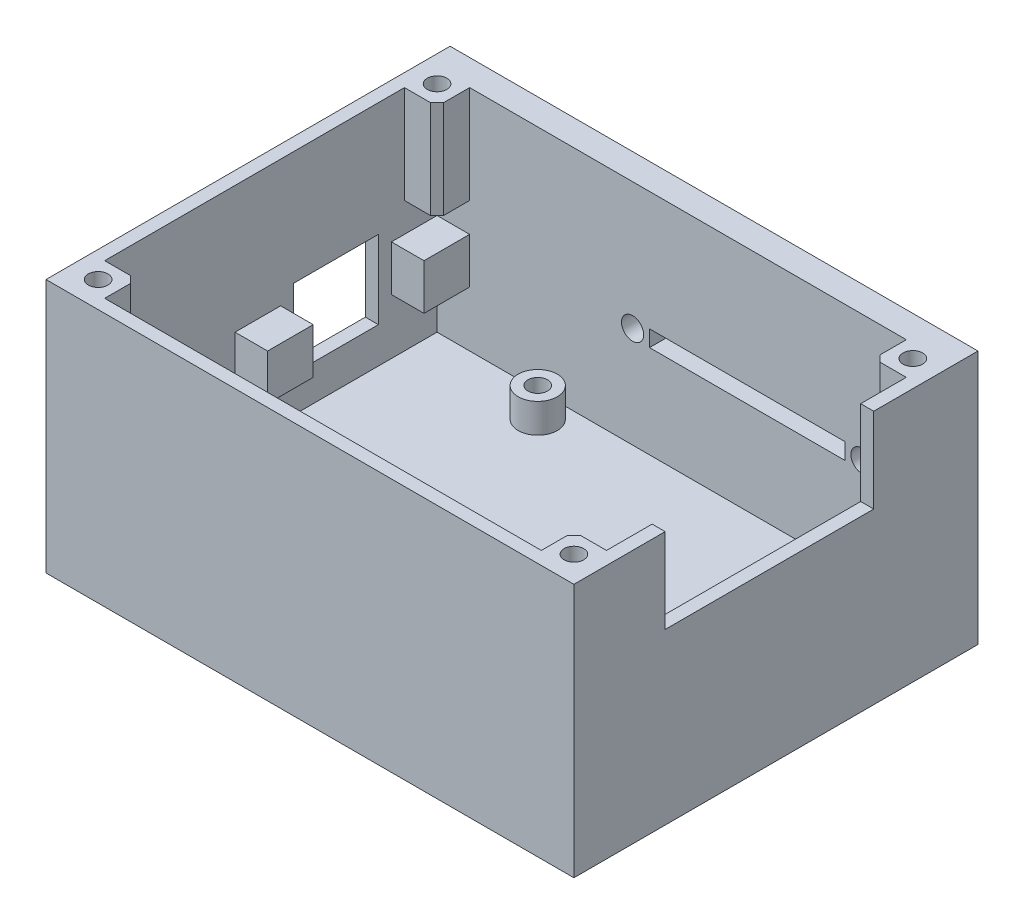
from build123d import *

# Parameters (mm, degrees)
SKETCH1_W           = 81
SKETCH1_H           = 62
EXTRUDE1_DEPTH      = 4
SKETCH2_W           = 81
SKETCH2_H           = 62
SKETCH2_W_2         = 77
SKETCH2_H_2         = 56
EXTRUDE2_DEPTH      = 35
SKETCH3_R           = 3
EXTRUDE3_DEPTH      = 4.5
SKETCH4_R           = 1.5
EXTRUDE4_DEPTH      = 4.5
EXTRUDE5_DEPTH      = 96.425363505
EXTRUDE5_DEPTH_BACK = 8
SKETCH5_R           = 1.25
SKETCH5_W           = 13
SKETCH5_H           = 12
EXTRUDE6_REACH      = 97.425
SKETCH6_W           = 32
SKETCH6_H           = 13
EXTRUDE12_START     = 24
SKETCH8_W           = 5
SKETCH8_H           = 5
EXTRUDE12_DEPTH     = 15
SKETCH10_R          = 1.5
EXTRUDE13_DEPTH     = 10
CHAMFER5_SIZE       = 1
SKETCH12_R          = 1.7
SKETCH12_W          = 30
SKETCH12_H          = 2.5
EXTRUDE15_DEPTH     = 4
SKETCH13_W          = 7
SKETCH13_H          = 7
EXTRUDE16_DEPTH     = 5
SKETCH14_R          = 1.25
EXTRUDE17_DEPTH     = 3
EXTRUDE18_DEPTH     = 1


with BuildPart() as part:
    # Sketch1 → Extrude1 (new body)
    with BuildSketch(Plane(origin=(0, 0, 0), x_dir=(1, 0, 0), z_dir=(0, 1, 0))):
        with Locations((0, 1)):
            Rectangle(SKETCH1_W, SKETCH1_H)
    extrude(amount=EXTRUDE1_DEPTH)

    # Sketch2 → Extrude2 (add)
    with BuildSketch(Plane(origin=(0, 4, 0), x_dir=(1, 0, 0), z_dir=(0, 1, 0))):
        with Locations((0, 1)):
            Rectangle(SKETCH2_W, SKETCH2_H)
        Rectangle(SKETCH2_W_2, SKETCH2_H_2, mode=Mode.SUBTRACT)
    extrude(amount=EXTRUDE2_DEPTH)

    # Sketch3 → Extrude3 (add)
    with BuildSketch(Plane(origin=(0, 4, 0), x_dir=(1, 0, 0), z_dir=(0, 1, 0))):
        with Locations(Location((31.6, -18.95, 0), (0, 0, 270))):
            Circle(SKETCH3_R)
        with Locations(Location((-20.3, -23.65, 0), (0, 0, 270))):
            Circle(SKETCH3_R)
        with Locations(Location((-19.2, 24.15, 0), (0, 0, 270))):
            Circle(SKETCH3_R)
        with Locations(Location((31.6, 8.95, 0), (0, 0, 270))):
            Circle(SKETCH3_R)
    extrude(amount=EXTRUDE3_DEPTH)

    # Sketch4 → Extrude4 (cut)
    with BuildSketch(Plane(origin=(0, 8.5, 0), x_dir=(1, 0, 0), z_dir=(0, 1, 0))):
        with Locations(Location((-19.2, 24.15, 0), (0, 0, 270))):
            Circle(SKETCH4_R)
        with Locations(Location((31.6, 8.95, 0), (0, 0, 270))):
            Circle(SKETCH4_R)
        with Locations(Location((31.6, -18.95, 0), (0, 0, 270))):
            Circle(SKETCH4_R)
        with Locations(Location((-20.3, -23.65, 0), (0, 0, 270))):
            Circle(SKETCH4_R)
    extrude(amount=-EXTRUDE4_DEPTH, mode=Mode.SUBTRACT)

    # Sketch5 → Extrude5 (cut, two sides: drawn at the far end of the back side and taken through both)
    with BuildSketch(Plane.ZY.offset(40.5).offset(-EXTRUDE5_DEPTH_BACK)):
        with Locations(Location((-0.5, 16, 0), (0, 0, 180))):
            Circle(SKETCH5_R)
        with Locations(Location((-24.5, 16, 0), (0, 0, 180))):
            Circle(SKETCH5_R)
        with Locations((-12.5, 15.5)):
            Rectangle(SKETCH5_W, SKETCH5_H)
    extrude(amount=EXTRUDE5_DEPTH + EXTRUDE5_DEPTH_BACK, mode=Mode.SUBTRACT)

    # Sketch6 → Extrude6 (cut, up to next)
    with BuildSketch(Plane(origin=(40.5, 0, 0), x_dir=(0, 0, -1), z_dir=(1, 0, 0)), mode=Mode.PRIVATE) as extrude6_sk1:
        with Locations((0, 32.5)):
            Rectangle(SKETCH6_W, SKETCH6_H)
    extrude6_tool1 = extrude(extrude6_sk1.sketch, amount=-EXTRUDE6_REACH, mode=Mode.PRIVATE) & part.part
    add(extrude6_tool1.solids().sort_by_distance((40.5, 32.5, 0))[0], mode=Mode.SUBTRACT)

    # Sketch8 → Extrude12 (add)
    with BuildSketch(Plane(origin=(0, 0, 0), x_dir=(1, 0, 0), z_dir=(0, 1, 0)).offset(EXTRUDE12_START)):
        with Locations((-36, 25.5)):
            Rectangle(SKETCH8_W, SKETCH8_H)
        with Locations((-36, -25.5)):
            Rectangle(SKETCH8_W, SKETCH8_H)
        with Locations((36, 25.5)):
            Rectangle(SKETCH8_W, SKETCH8_H)
        with Locations((36, -25.5)):
            Rectangle(SKETCH8_W, SKETCH8_H)
    extrude(amount=EXTRUDE12_DEPTH)

    # Sketch10 → Extrude13 (cut)
    with BuildSketch(Plane(origin=(0, 39, 0), x_dir=(1, 0, 0), z_dir=(0, 1, 0))):
        with Locations(Location((-36.5, 26, 0), (0, 0, 270))):
            Circle(SKETCH10_R)
        with Locations(Location((36.5, 26, 0), (0, 0, 270))):
            Circle(SKETCH10_R)
        with Locations(Location((36.5, -26, 0), (0, 0, 270))):
            Circle(SKETCH10_R)
        with Locations(Location((-36.5, -26, 0), (0, 0, 270))):
            Circle(SKETCH10_R)
    extrude(amount=-EXTRUDE13_DEPTH, mode=Mode.SUBTRACT)

    # Chamfer5
    chamfer5_edges = [part.edges().sort_by_distance(p)[0] for p in [
        (-33.5, 31.5, -23),
        (-33.5, 31.5, 23),
        (33.5, 31.5, -23),
        (33.5, 31.5, 23),
    ]]
    chamfer(chamfer5_edges, length=CHAMFER5_SIZE)

    # Sketch12 → Extrude15 (cut)
    with BuildSketch(Plane(origin=(0, 0, -32), x_dir=(-1, 0, 0), z_dir=(0, 0, -1))):
        with Locations((-26.7, 19.5)):
            Circle(SKETCH12_R)
        with Locations((8.5, 19.5)):
            Circle(SKETCH12_R)
        with Locations((-9.1, 19.5)):
            Rectangle(SKETCH12_W, SKETCH12_H)
    extrude(amount=-EXTRUDE15_DEPTH, mode=Mode.SUBTRACT)

    # Sketch13 → Extrude16 (add)
    with BuildSketch(Plane(origin=(-38.5, 0, 0), x_dir=(0, 0, -1), z_dir=(1, 0, 0))):
        with Locations((0.5, 16)):
            Rectangle(SKETCH13_W, SKETCH13_H)
        with Locations((24.5, 16)):
            Rectangle(SKETCH13_W, SKETCH13_H)
    extrude(amount=EXTRUDE16_DEPTH)

    # Sketch14 → Extrude17 (cut)
    with BuildSketch(Plane.ZY.offset(38.5)):
        with Locations(Location((-0.5, 16, 0), (0, 0, 180))):
            Circle(SKETCH14_R)
        with Locations(Location((-24.5, 16, 0), (0, 0, 180))):
            Circle(SKETCH14_R)
    extrude(amount=-EXTRUDE17_DEPTH, mode=Mode.SUBTRACT)

    # Sketch15 → Extrude18 (cut)
    # profile 1 of 3: a face of its own
    with BuildSketch(Plane.XZ):
        with BuildLine():
            Line((-11.468328751, 5.454636927), (-14.100540289, 2.938611286))
            add(Edge.make_bspline(
                [(-14.100540289, 2.938611286), (-14.323825916, 3.169488999), (-14.759972698, 3.620465502), (-15.462769298, 4.21751865), (-16.193652173, 4.715081665), (-16.938403455, 5.134126068), (-17.710419061, 5.451163024), (-18.500772389, 5.682193194), (-19.314510076, 5.823043557), (-19.865216444, 5.839159331), (-20.142206956, 5.847265132)],
                knots=[0, 0, 0, 0, 1.115251505, 2.178435587, 3.19620269, 4.182487026, 5.141301733, 6.088180966, 7.038406374, 8, 8, 8, 8], degree=3))
            add(Edge.make_bspline(
                [(-20.142206956, 5.847265132), (-20.373527694, 5.840861266), (-20.830013685, 5.828223941), (-21.500254742, 5.735579883), (-22.141374952, 5.57803463), (-22.75556897, 5.360908089), (-23.341029506, 5.079957868), (-23.898984048, 4.735401417), (-24.428056984, 4.330350569), (-24.921259567, 3.866901077), (-25.372423956, 3.36054768), (-25.771056422, 2.820269814), (-26.104975056, 2.247305224), (-26.379016647, 1.647456476), (-26.592484454, 1.017947171), (-26.744927287, 0.359201121), (-26.833096148, -0.32956619), (-26.846255941, -0.797785076), (-26.852944135, -1.035747688)],
                knots=[0, 0, 0, 0, 1.035432265, 2.043311493, 3.022114605, 3.98653278, 4.95457646, 5.923598177, 6.917315552, 7.932509744, 8.948865224, 9.949768934, 10.933144597, 11.912367597, 12.897413939, 13.903909035, 14.934704909, 16, 16, 16, 16], degree=3))
            add(Edge.make_bspline(
                [(-26.852944135, -1.035747688), (-26.851016674, -1.202766499), (-26.847217608, -1.531964006), (-26.805630115, -2.018938485), (-26.738664445, -2.491418856), (-26.641748528, -2.948689437), (-26.520554222, -3.391146502), (-26.378365706, -3.822607107), (-26.199992303, -4.237109437), (-26.001995135, -4.639467668), (-25.77172671, -5.018702952), (-25.523454869, -5.380335269), (-25.254244592, -5.722591933), (-24.962352188, -6.044073789), (-24.643669634, -6.339756795), (-24.306433697, -6.618532492), (-23.944955671, -6.873422179), (-23.566744372, -7.110822593), (-23.168532533, -7.317054352), (-22.761124562, -7.503860484), (-22.338343335, -7.655574837), (-21.905336468, -7.777870446), (-21.463651372, -7.881864597), (-21.00896796, -7.945896992), (-20.545227765, -7.994387975), (-20.231817232, -7.99738201), (-20.074097982, -7.998888714)],
                knots=[0, 0, 0, 0, 1.103660481, 2.175337485, 3.227646561, 4.255952547, 5.262355991, 6.258840057, 7.255597736, 8.242457506, 9.22035537, 10.185017736, 11.140346927, 12.096287581, 13.051739095, 14.01125915, 14.986044842, 15.97314143, 16.960198552, 17.947847494, 18.933482797, 19.925264591, 20.920966487, 21.929612487, 22.958107872, 24, 24, 24, 24], degree=3))
            add(Edge.make_bspline(
                [(-20.074097982, -7.998888714), (-19.806579028, -7.991150646), (-19.280973849, -7.975947355), (-18.509572673, -7.857059772), (-17.774504203, -7.661496426), (-17.187188013, -7.430547477), (-16.727041292, -7.202482393), (-16.376738395, -6.99153342), (-16.014497897, -6.755563834), (-15.646336304, -6.485667885), (-15.268112526, -6.185084434), (-14.886503087, -5.847230143), (-14.491738716, -5.483230068), (-14.233132489, -5.223436064), (-14.100540289, -5.090234868)],
                knots=[0, 0, 0, 0, 1.404581149, 2.759636711, 4.088442092, 5.392261763, 6.066678138, 6.783632037, 7.538459478, 8.336747902, 9.180226004, 10.074962426, 11.012997595, 12, 12, 12, 12], degree=3))
            Line((-14.100540289, -5.090234868), (-11.548456956, -7.770523329))
            add(Edge.make_bspline(
                [(-11.548456956, -7.770523329), (-11.727854678, -7.943726197), (-12.078000665, -8.281781155), (-12.606186166, -8.76178765), (-13.133706924, -9.193126846), (-13.647819138, -9.591454465), (-14.156944501, -9.945166256), (-14.661029022, -10.254615477), (-15.154366243, -10.527628544), (-15.647200469, -10.759601226), (-16.142598371, -10.956570126), (-16.652304594, -11.126147421), (-17.177877359, -11.269603712), (-17.722526625, -11.385354098), (-18.281172234, -11.478170281), (-18.859042369, -11.540820668), (-19.452473046, -11.582938439), (-19.855006267, -11.58672307), (-20.058072341, -11.588632303)],
                knots=[0, 0, 0, 0, 1.244526981, 2.429050516, 3.560637417, 4.644440555, 5.67424972, 6.652764056, 7.595344123, 8.486817594, 9.369275933, 10.254498637, 11.166417451, 12.086725134, 13.032340136, 13.991389299, 14.986715468, 16, 16, 16, 16], degree=3))
            add(Edge.make_bspline(
                [(-20.058072341, -11.588632303), (-20.431079563, -11.579123606), (-21.160951014, -11.560517727), (-22.230558595, -11.422660762), (-23.246657085, -11.191545988), (-24.211718461, -10.864685953), (-25.125435857, -10.447137575), (-25.987575516, -9.935242871), (-26.796747859, -9.330361864), (-27.546416368, -8.639584346), (-28.224527213, -7.876678567), (-28.823898671, -7.057527057), (-29.319698763, -6.178103986), (-29.731372263, -5.251401241), (-30.053295525, -4.273189918), (-30.279874927, -3.242411891), (-30.419604791, -2.160062439), (-30.434891437, -1.420792814), (-30.442687725, -1.043760509)],
                knots=[0, 0, 0, 0, 1.078019885, 2.10938526, 3.111377082, 4.085535484, 5.04941344, 6.010039228, 6.978205633, 7.964457913, 8.951525778, 9.924444315, 10.892603023, 11.863865945, 12.85144698, 13.863884204, 14.910567087, 16, 16, 16, 16], degree=3))
            add(Edge.make_bspline(
                [(-30.442687725, -1.043760509), (-30.439393392, -0.797863256), (-30.432864827, -0.310555001), (-30.364249014, 0.407289539), (-30.26859458, 1.107059563), (-30.116847519, 1.781489139), (-29.933931403, 2.439664078), (-29.70645118, 3.074430785), (-29.434770168, 3.687613646), (-29.127645285, 4.280239164), (-28.780197978, 4.848425008), (-28.392061194, 5.387289566), (-27.973227086, 5.900992773), (-27.513631755, 6.382719402), (-27.019953721, 6.836699107), (-26.489964085, 7.260471685), (-25.92685047, 7.660114512), (-25.329088737, 8.02532177), (-24.708291804, 8.355671147), (-24.072289553, 8.647053406), (-23.422644569, 8.890581874), (-22.762103609, 9.092579756), (-22.087875897, 9.243356891), (-21.404773897, 9.357490318), (-20.706985232, 9.421291634), (-20.238480595, 9.431736316), (-20.001982597, 9.437008722)],
                knots=[0, 0, 0, 0, 1.071919942, 2.124283339, 3.142214191, 4.149696895, 5.136002878, 6.119640489, 7.086990633, 8.058538607, 9.028339693, 9.988281803, 10.952401235, 11.916291999, 12.888973767, 13.874849856, 14.873389453, 15.898127285, 16.927174885, 17.938320013, 18.946391617, 19.950418109, 20.947802303, 21.956882652, 22.968648068, 24, 24, 24, 24], degree=3))
            add(Edge.make_bspline(
                [(-20.001982597, 9.437008722), (-19.800225556, 9.433986448), (-19.398809185, 9.427973322), (-18.801032848, 9.377847376), (-18.208037246, 9.299125086), (-17.621945486, 9.180349914), (-17.03856524, 9.039348775), (-16.465562778, 8.854727234), (-15.893898676, 8.648931734), (-15.332538638, 8.402945234), (-14.780699086, 8.13442875), (-14.251307732, 7.829787048), (-13.735476143, 7.507767437), (-13.244634838, 7.149311387), (-12.769589302, 6.767420764), (-12.312823591, 6.360313835), (-11.878346089, 5.921202931), (-11.605692133, 5.610945157), (-11.468328751, 5.454636927)],
                knots=[0, 0, 0, 0, 0.996412454, 1.982464992, 2.961075852, 3.949442424, 4.934965278, 5.923860011, 6.921385422, 7.934793307, 8.949617135, 9.951082467, 10.950285876, 11.951772932, 12.951063433, 13.960125323, 14.972308753, 16, 16, 16, 16], degree=3))
        make_face()
    # profile 2 of 3: a face of its own
    with BuildSketch(Plane.XZ):
        Polygon((-1.720732597, 8.924188209), (1.608594326, 8.924188209), (9.685517403, -11.075811791), (5.851382788, -11.075811791), (4.296895608, -6.973247688), (-4.4170467, -6.973247688), (-5.971533879, -11.075811791), (-9.801662084, -11.075811791), align=None)
        Polygon((-0.058072341, 3.559604876), (-3.054867212, -3.383504098), (2.938722531, -3.383504098), align=None, mode=Mode.SUBTRACT)
    # profile 3 of 3: a face of its own
    with BuildSketch(Plane.XZ):
        Polygon((12.634235352, 8.924188209), (15.867408429, 8.924188209), (24.941927659, -4.236869483), (24.941927659, 8.924188209), (28.531671249, 8.924188209), (28.531671249, -11.075811791), (25.274459711, -11.075811791), (16.223978941, 2.045181799), (16.223978941, -11.075811791), (12.634235352, -11.075811791), align=None)
    extrude(amount=-EXTRUDE18_DEPTH, mode=Mode.SUBTRACT)


solid = part.part
